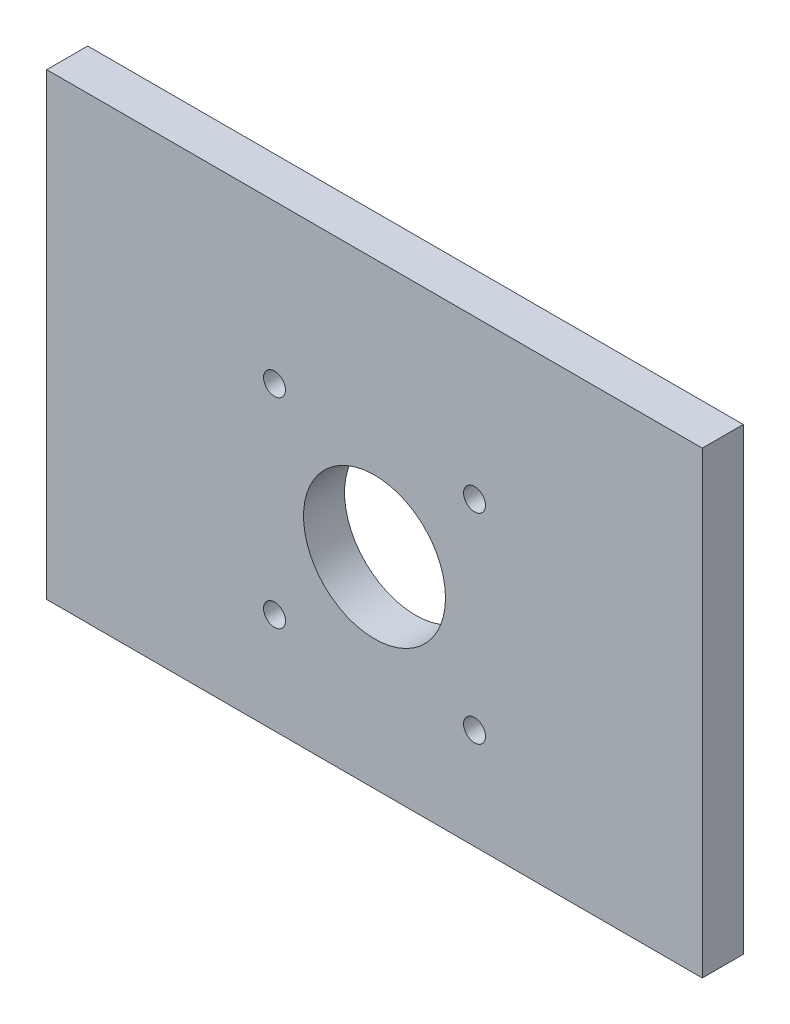
from build123d import *

# Parameters (mm, degrees)
SKETCH1_W              = 101.6
SKETCH1_H              = 71.12
BASE_DEPTH             = 6.35
MOTOR_MOUNTING_HOLES_D = 3.4
SKETCH4_R              = 11
CUT_EXTRUDE1_DEPTH     = 125.181064982


with BuildPart() as part:
    # Sketch1 → base (new body)
    with BuildSketch(Plane.XY):
        with Locations((50.8, 35.56)):
            Rectangle(SKETCH1_W, SKETCH1_H)
    extrude(amount=BASE_DEPTH)

    # motor mounting holes (through all)
    with Locations(Plane.XY.offset(6.35)):
        with Locations((35.3, 46.615), (66.3, 15.615), (35.3, 15.615), (66.3, 46.615)):
            Hole(MOTOR_MOUNTING_HOLES_D / 2)

    # Sketch4 → Cut-Extrude1 (cut, through all)
    with BuildSketch(Plane.XY.offset(6.35)):
        with Locations((50.8, 31.115)):
            Circle(SKETCH4_R)
    extrude(amount=-CUT_EXTRUDE1_DEPTH, mode=Mode.SUBTRACT)


solid = part.part
